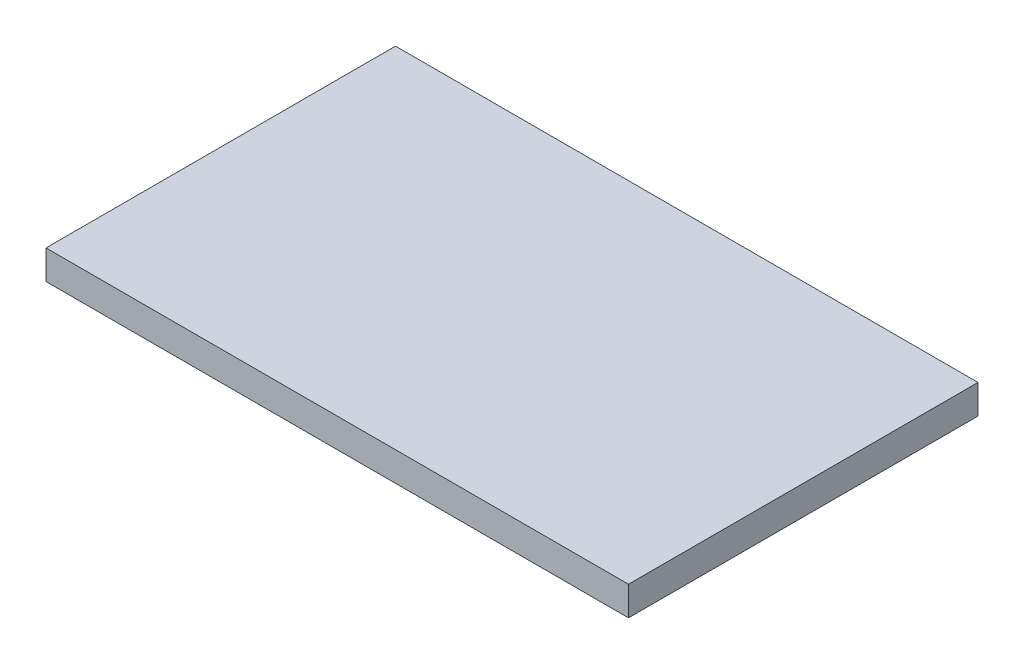
from build123d import *

# Parameters (mm, degrees)
SKETCH1_W           = 127
SKETCH1_H           = 6.35
BOSS_EXTRUDE1_DEPTH = 76.2


with BuildPart() as part:
    # Sketch1 → Boss-Extrude1 (new body)
    with BuildSketch(Plane.XY):
        with Locations((25.4, 34.925)):
            Rectangle(SKETCH1_W, SKETCH1_H)
    extrude(amount=BOSS_EXTRUDE1_DEPTH)


solid = part.part
